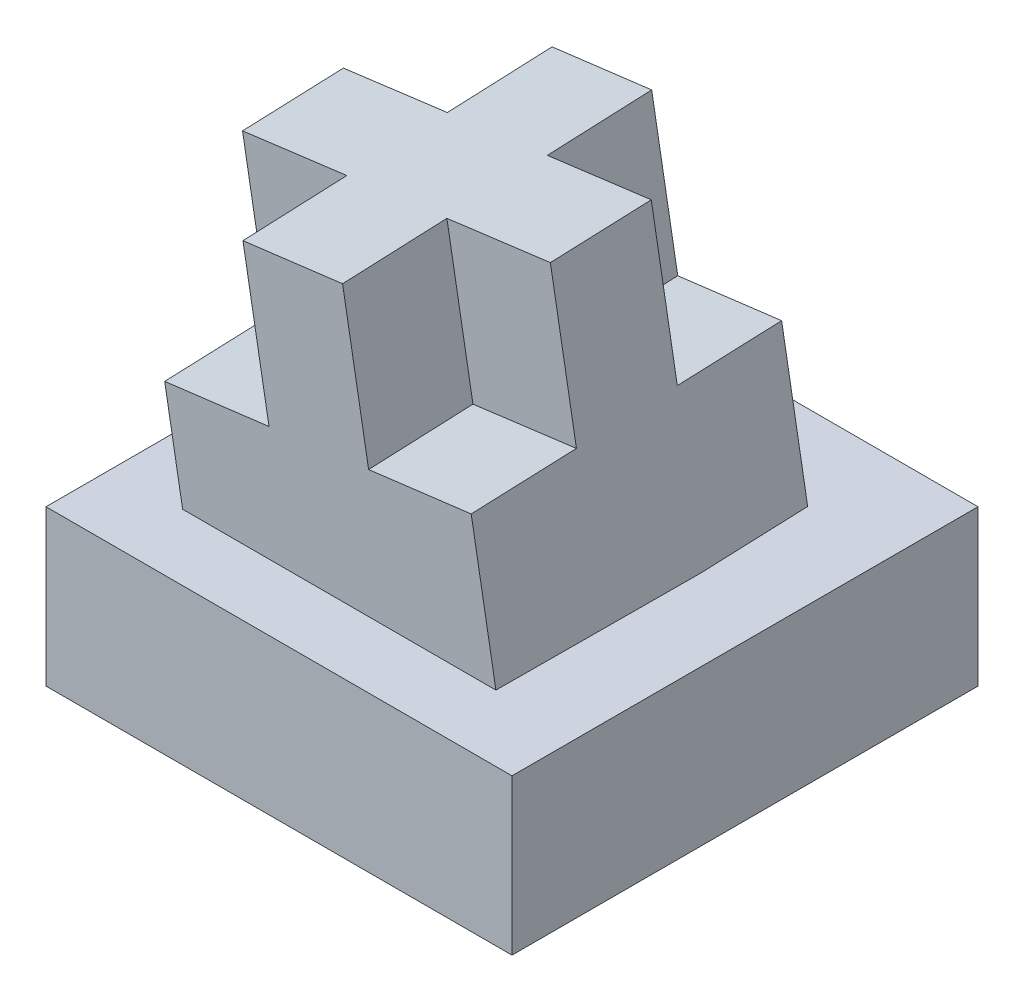
from build123d import *

# Parameters (mm, degrees)
SKETCH1_W           = 30
SKETCH1_H           = 30
BOSS_EXTRUDE1_DEPTH = 10
SKETCH2_W           = 20
SKETCH2_H           = 20
BOSS_EXTRUDE2_DEPTH = 20
CUT_EXTRUDE3_DEPTH  = 10


with BuildPart() as part:
    # Sketch1 → Boss-Extrude1 (new body)
    with BuildSketch(Plane(origin=(0, 0, 0), x_dir=(1, 0, 0), z_dir=(0, 1, 0))):
        Rectangle(SKETCH1_W, SKETCH1_H)
    extrude(amount=BOSS_EXTRUDE1_DEPTH)

    # Sketch2 → Boss-Extrude2 (add)
    with BuildSketch(Plane(origin=(-19.996706831, 6.023656636, 0.235617172), x_dir=(-0.9916527006816696, -0.12883913939699687, -0.005039582343056198), z_dir=(0.12893766412786933, -0.9908949522292337, -0.03875915912237427))):
        with Locations((-20.018899737, -0.342067519)):
            Rectangle(SKETCH2_W, SKETCH2_H)
    extrude(amount=-BOSS_EXTRUDE2_DEPTH)

    # Sketch5 → Cut-Extrude3 (cut)
    with BuildSketch(Plane(origin=(-2.292112058, 28.477077557, 1.107866318), x_dir=(0.9916435574745326, 0.12900579254219657, 0.0007486052452988832), z_dir=(-0.12893766412786928, 0.9908949522292337, 0.03875915912237423))):
        Polygon((-3.672779426, -10.332409771), (-3.672779426, -3.610260169), (-10.450784263, -3.610260169), (-10.479525344, -10.303179891), align=None)
        Polygon((2.827220574, -10.360322406), (2.827220574, -3.610200238), (9.549400399, -3.610200238), (9.520290252, -10.389064131), align=None)
        Polygon((-10.393641105, 9.696635705), (-3.672779426, 9.667774634), (-3.672779426, 2.889739831), (-10.422871628, 2.889739831), align=None)
        Polygon((9.606174491, 9.610751466), (9.577312777, 2.889739831), (2.827220574, 2.889739831), (2.827220574, 9.639861999), align=None)
    extrude(amount=-CUT_EXTRUDE3_DEPTH, mode=Mode.SUBTRACT)


solid = part.part
